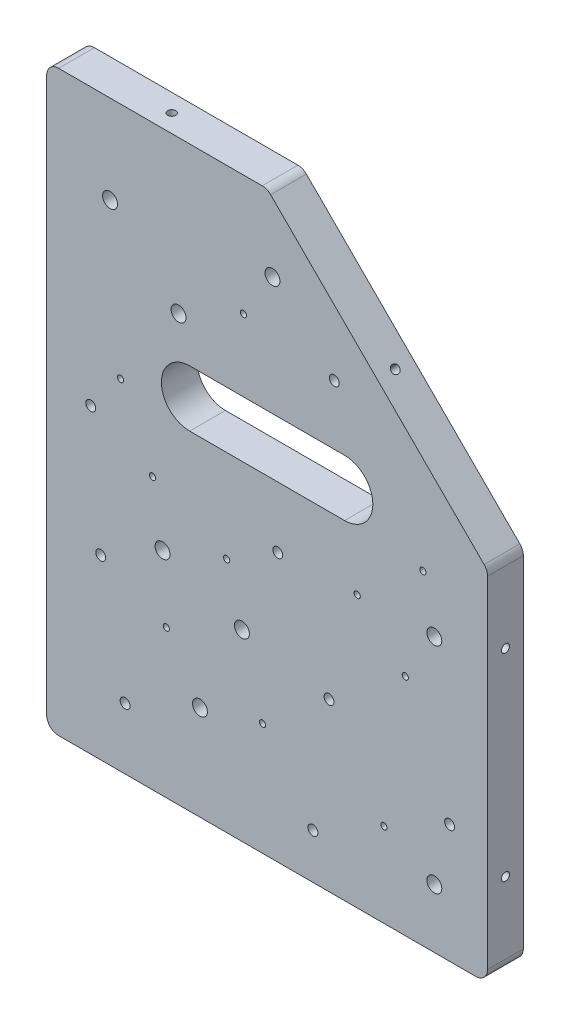
from build123d import *

# Parameters (mm, degrees)
BOSS_EXTRUDE2_DEPTH           = 30
FILLET2_R                     = 10
FILLET3_R                     = 10
TAP_DRILL_FOR_M5_HELICOIL1_D  = 5.2
TAP_DRILL_FOR_M8_HELICOIL4_D  = 8.3
TAP_DRILL_FOR_M12_HELICOIL1_D = 12.5
TAP_DRILL_FOR_M8_TAP1_D       = 6.8
TAP_DRILL_FOR_M8_TAP1_DEPTH   = 25
TAP_DRILL_FOR_M8_TAP1_TIP     = 2.042926105
TAP_DRILL_FOR_M8_TAP2_D       = 6.8
TAP_DRILL_FOR_M8_TAP2_DEPTH   = 25
TAP_DRILL_FOR_M8_TAP2_TIP     = 2.042926105
TAP_DRILL_FOR_M8_TAP4_D       = 6.8
TAP_DRILL_FOR_M8_TAP4_DEPTH   = 25
TAP_DRILL_FOR_M8_TAP4_TIP     = 2.042926105
TAP_DRILL_FOR_M8_TAP5_D       = 6.8
TAP_DRILL_FOR_M8_TAP5_DEPTH   = 25
TAP_DRILL_FOR_M8_TAP5_TIP     = 2.042926105


with BuildPart() as part:
    # Sketch1 → Boss-Extrude2 (new body)
    with BuildSketch(Plane.XY):
        Polygon((0, 0), (370, 0), (370, 300), (185, 485), (0, 485), (0, 300), align=None)
        with BuildLine():
            Line((120, 323.710101352), (250, 323.710101352))
            ThreePointArc((250, 323.710101352), (273.710101352, 300), (250, 276.289898648))
            Line((250, 276.289898648), (120, 276.289898648))
            ThreePointArc((120, 276.289898648), (96.289898648, 300), (120, 323.710101352))
        make_face(mode=Mode.SUBTRACT)
    extrude(amount=BOSS_EXTRUDE2_DEPTH)

    # Fillet2
    fillet2_edges = [part.edges().sort_by_distance(p)[0] for p in [
        (370, 0, 15),
        (0, 0, 15),
    ]]
    fillet(fillet2_edges, radius=FILLET2_R)

    # Fillet3
    fillet3_edges = [part.edges().sort_by_distance(p)[0] for p in [
        (0, 485, 15),
        (185, 485, 15),
        (370, 300, 15),
    ]]
    fillet(fillet3_edges, radius=FILLET3_R)

    # Tap Drill for M5 Helicoil1 (through all)
    with Locations(Plane.XY.offset(30)):
        with Locations((300.970994454, 188.552878957), (181.155657642, 94.366491196), (100.424468133, 123.839782605), (151.041642508, 198.804458578), (260.6053997, 227.63702626), (283.030730119, 70.659713324), (88.89144106, 227.63702626), (165.137564486, 383.973615469), (315.707640159, 272.487687099), (61.981044557, 285.302161624)):
            Hole(TAP_DRILL_FOR_M5_HELICOIL1_D / 2)

    # Tap Drill for M8 Helicoil4 (through all)
    with Locations(Plane.XY.offset(30)):
        with Locations((65.825386914, 51.438001536), (45.322227674, 148.828007929), (236.898621828, 139.857875761), (241.383687912, 373.722035849), (338.132970578, 99.492281006), (223.443423576, 37.982803285), (193.970132168, 225.074131355), (36.992819232, 253.26597531)):
            Hole(TAP_DRILL_FOR_M8_HELICOIL4_D / 2)

    # Tap Drill for M12 Helicoil1 (through all)
    with Locations(Plane.XY.offset(30)):
        with Locations((163.856117033, 153.953797739), (325.318496053, 49.561393209), (128.616312088, 79.629845492), (189.485066084, 423.057762771), (110.676047753, 357.063218966), (97.220849501, 178.301299337), (325.318496053, 229.559197439), (53.19045969, 410.886687746)):
            Hole(TAP_DRILL_FOR_M12_HELICOIL1_D / 2)

    # Tap Drill for M8 Tap1
    with Locations(Plane(origin=(0, 0, 0), x_dir=(-1, 0, 0), z_dir=(0, -1, 0))):
        with Locations((-65, -15), (-315, -15)):
            Hole(TAP_DRILL_FOR_M8_TAP1_D / 2, depth=TAP_DRILL_FOR_M8_TAP1_DEPTH)
            with Locations((0, 0, -(TAP_DRILL_FOR_M8_TAP1_DEPTH + TAP_DRILL_FOR_M8_TAP1_TIP / 2))):  # 118° drill point
                Cone(0, TAP_DRILL_FOR_M8_TAP1_D / 2, TAP_DRILL_FOR_M8_TAP1_TIP, mode=Mode.SUBTRACT)

    # Tap Drill for M8 Tap2
    with Locations(Plane(origin=(335, 335, 0), x_dir=(0.7071067811865478, -0.7071067811865474, 0), z_dir=(0.7071067811865474, 0.7071067811865478, 0))):
        with Locations((-81.317279836, -15)):
            Hole(TAP_DRILL_FOR_M8_TAP2_D / 2, depth=TAP_DRILL_FOR_M8_TAP2_DEPTH)
            with Locations((0, 0, -(TAP_DRILL_FOR_M8_TAP2_DEPTH + TAP_DRILL_FOR_M8_TAP2_TIP / 2))):  # 118° drill point
                Cone(0, TAP_DRILL_FOR_M8_TAP2_D / 2, TAP_DRILL_FOR_M8_TAP2_TIP, mode=Mode.SUBTRACT)

    # Tap Drill for M8 Tap4
    with Locations(Plane(origin=(0, 485, 0), x_dir=(1, 0, 0), z_dir=(0, 1, 0))):
        with Locations((90, -15)):
            Hole(TAP_DRILL_FOR_M8_TAP4_D / 2, depth=TAP_DRILL_FOR_M8_TAP4_DEPTH)
            with Locations((0, 0, -(TAP_DRILL_FOR_M8_TAP4_DEPTH + TAP_DRILL_FOR_M8_TAP4_TIP / 2))):  # 118° drill point
                Cone(0, TAP_DRILL_FOR_M8_TAP4_D / 2, TAP_DRILL_FOR_M8_TAP4_TIP, mode=Mode.SUBTRACT)

    # Tap Drill for M8 Tap5
    with Locations(Plane(origin=(370, 0, 0), x_dir=(0, 0, -1), z_dir=(1, 0, 0))):
        with Locations((-15, 235.857864376), (-15, 70)):
            Hole(TAP_DRILL_FOR_M8_TAP5_D / 2, depth=TAP_DRILL_FOR_M8_TAP5_DEPTH)
            with Locations((0, 0, -(TAP_DRILL_FOR_M8_TAP5_DEPTH + TAP_DRILL_FOR_M8_TAP5_TIP / 2))):  # 118° drill point
                Cone(0, TAP_DRILL_FOR_M8_TAP5_D / 2, TAP_DRILL_FOR_M8_TAP5_TIP, mode=Mode.SUBTRACT)


solid = part.part
